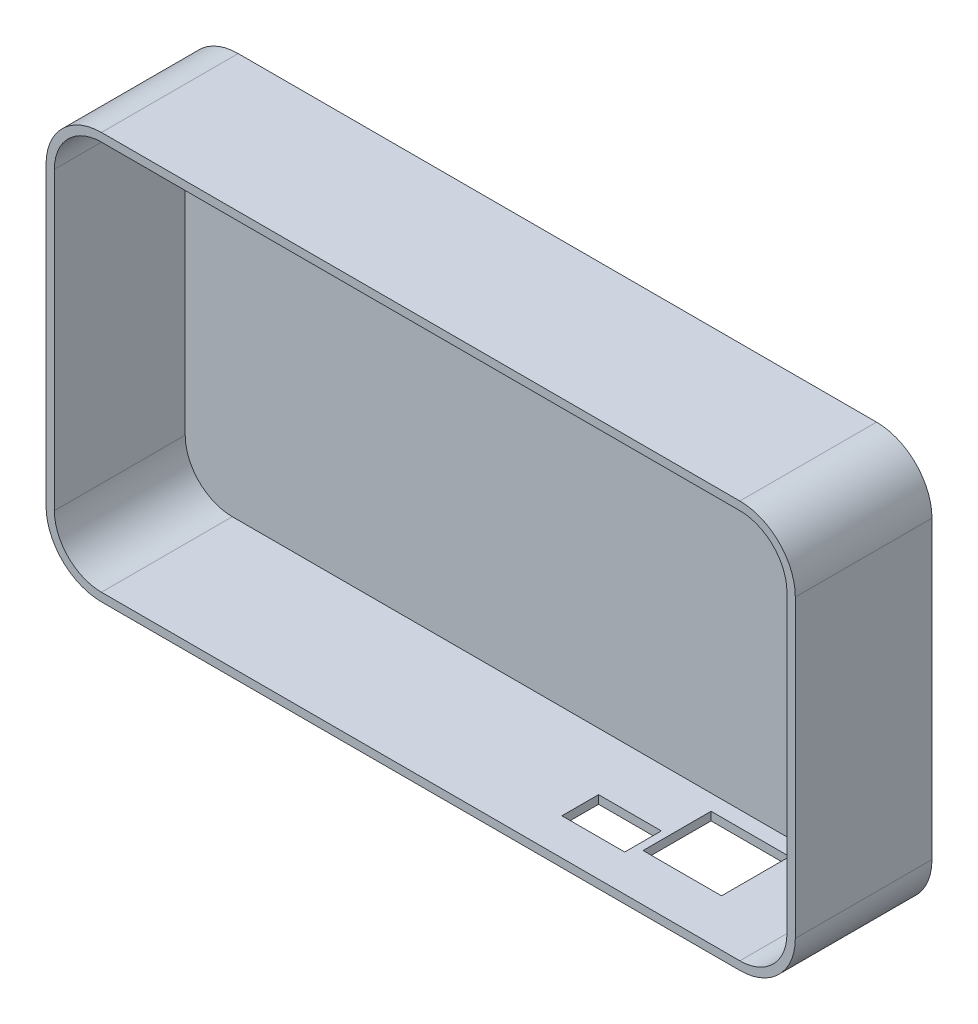
from build123d import *

# Parameters (mm, degrees)
PARED_DEPTH           = 25
CONECTORES_REACH      = 165.441
CROQUIS2_W            = 15
CROQUIS2_H            = 13
CROQUIS2_W_2          = 12
CROQUIS2_H_2          = 7
BASE_START            = -1.12
BASE_FRENTE_DEPTH     = 1.12
CORTAR_EXTRUIR2_REACH = 164.686
CROQUIS3_W            = 2
CROQUIS3_H            = 5.5


with BuildPart() as part:
    # Croquis1 → pared (new body)
    with BuildSketch(Plane.XY):
        with BuildLine():
            Line((9, 76.1), (131, 76.1))
            ThreePointArc((131, 76.1), (138.495331881, 72.995331881), (141.6, 65.5))
            Line((141.6, 65.5), (141.6, 9))
            ThreePointArc((141.6, 9), (138.495331881, 1.504668119), (131, -1.6))
            Line((131, -1.6), (9, -1.6))
            ThreePointArc((9, -1.6), (1.504668119, 1.504668119), (-1.6, 9))
            Line((-1.6, 9), (-1.6, 65.5))
            ThreePointArc((-1.6, 65.5), (1.504668119, 72.995331881), (9, 76.1))
        make_face()
        with BuildLine():
            Line((9, 0), (131, 0))
            ThreePointArc((131, 0), (137.363961031, 2.636038969), (140, 9))
            Line((140, 9), (140, 65.5))
            ThreePointArc((140, 65.5), (137.363961031, 71.863961031), (131, 74.5))
            Line((131, 74.5), (9, 74.5))
            ThreePointArc((9, 74.5), (2.636038969, 71.863961031), (0, 65.5))
            Line((0, 65.5), (0, 9))
            ThreePointArc((0, 9), (2.636038969, 2.636038969), (9, 0))
        make_face(mode=Mode.SUBTRACT)
    extrude(amount=PARED_DEPTH)

    # Croquis2 → conectores (cut, up to next)
    with BuildSketch(Plane.XZ.offset(1.6), mode=Mode.PRIVATE) as conectores_sk1:
        with Locations((111, 9.5)):
            Rectangle(CROQUIS2_W, CROQUIS2_H)
    conectores_tool1 = extrude(conectores_sk1.sketch, amount=-CONECTORES_REACH, mode=Mode.PRIVATE) & part.part
    # Croquis2 → conectores (cut, up to next)
    with BuildSketch(Plane.XZ.offset(1.6), mode=Mode.PRIVATE) as conectores_sk2:
        with Locations((96, 14.5)):
            Rectangle(CROQUIS2_W_2, CROQUIS2_H_2)
    conectores_tool2 = extrude(conectores_sk2.sketch, amount=-CONECTORES_REACH, mode=Mode.PRIVATE) & part.part
    add(conectores_tool1.solids().sort_by_distance((111, -1.6, 9.5))[0], mode=Mode.SUBTRACT)
    add(conectores_tool2.solids().sort_by_distance((96, -1.6, 14.5))[0], mode=Mode.SUBTRACT)

    # Croquis1<2> → base frente (add)
    with BuildSketch(Plane.XY.offset(BASE_START)):
        with BuildLine():
            Line((9, 76.1), (131, 76.1))
            ThreePointArc((131, 76.1), (138.495331881, 72.995331881), (141.6, 65.5))
            Line((141.6, 65.5), (141.6, 9))
            ThreePointArc((141.6, 9), (138.495331881, 1.504668119), (131, -1.6))
            Line((131, -1.6), (9, -1.6))
            ThreePointArc((9, -1.6), (1.504668119, 1.504668119), (-1.6, 9))
            Line((-1.6, 9), (-1.6, 65.5))
            ThreePointArc((-1.6, 65.5), (1.504668119, 72.995331881), (9, 76.1))
        make_face()
    extrude(amount=BASE_FRENTE_DEPTH)

    # Croquis3 → Cortar-Extruir2 (cut, up to next)
    with BuildSketch(Plane.XY, mode=Mode.PRIVATE) as cortar_extruir2_sk1:
        with Locations((132, 38.25)):
            Rectangle(CROQUIS3_W, CROQUIS3_H)
    cortar_extruir2_tool1 = extrude(cortar_extruir2_sk1.sketch, amount=-CORTAR_EXTRUIR2_REACH, mode=Mode.PRIVATE) & part.part
    # Croquis3 → Cortar-Extruir2 (cut, up to next)
    with BuildSketch(Plane.XY, mode=Mode.PRIVATE) as cortar_extruir2_sk2:
        with BuildLine():
            Line((133, 34.5), (131, 34.5))
            Line((131, 34.5), (131, 29.5))
            ThreePointArc((131, 29.5), (131.146446609, 29.146446609), (131.5, 29))
            Line((131.5, 29), (132.5, 29))
            ThreePointArc((132.5, 29), (132.853553391, 29.146446609), (133, 29.5))
            Line((133, 29.5), (133, 34.5))
        make_face()
    cortar_extruir2_tool2 = extrude(cortar_extruir2_sk2.sketch, amount=-CORTAR_EXTRUIR2_REACH, mode=Mode.PRIVATE) & part.part
    # Croquis3 → Cortar-Extruir2 (cut, up to next)
    with BuildSketch(Plane.XY, mode=Mode.PRIVATE) as cortar_extruir2_sk3:
        with Locations((132, 44.75)):
            Rectangle(CROQUIS3_W, CROQUIS3_H)
    cortar_extruir2_tool3 = extrude(cortar_extruir2_sk3.sketch, amount=-CORTAR_EXTRUIR2_REACH, mode=Mode.PRIVATE) & part.part
    # Croquis3 → Cortar-Extruir2 (cut, up to next)
    with BuildSketch(Plane.XY, mode=Mode.PRIVATE) as cortar_extruir2_sk4:
        with BuildLine():
            Line((131, 53.5), (131, 48.5))
            Line((131, 48.5), (133, 48.5))
            Line((133, 48.5), (133, 53.5))
            ThreePointArc((133, 53.5), (132.853553391, 53.853553391), (132.5, 54))
            Line((132.5, 54), (131.5, 54))
            ThreePointArc((131.5, 54), (131.146446609, 53.853553391), (131, 53.5))
        make_face()
    cortar_extruir2_tool4 = extrude(cortar_extruir2_sk4.sketch, amount=-CORTAR_EXTRUIR2_REACH, mode=Mode.PRIVATE) & part.part
    # Croquis3 → Cortar-Extruir2 (cut, up to next)
    with BuildSketch(Plane.XY, mode=Mode.PRIVATE) as cortar_extruir2_sk5:
        with BuildLine():
            Line((132.5, 28), (131.5, 28))
            ThreePointArc((131.5, 28), (131.146446609, 27.853553391), (131, 27.5))
            Line((131, 27.5), (131, 13.5))
            ThreePointArc((131, 13.5), (131.146446609, 13.146446609), (131.5, 13))
            Line((131.5, 13), (132.5, 13))
            ThreePointArc((132.5, 13), (132.853553391, 13.146446609), (133, 13.5))
            Line((133, 13.5), (133, 27.5))
            ThreePointArc((133, 27.5), (132.853553391, 27.853553391), (132.5, 28))
        make_face()
    cortar_extruir2_tool5 = extrude(cortar_extruir2_sk5.sketch, amount=-CORTAR_EXTRUIR2_REACH, mode=Mode.PRIVATE) & part.part
    add(cortar_extruir2_tool1.solids().sort_by_distance((132, 38.25, 0))[0], mode=Mode.SUBTRACT)
    add(cortar_extruir2_tool2.solids().sort_by_distance((132, 31.775989, 0))[0], mode=Mode.SUBTRACT)
    add(cortar_extruir2_tool3.solids().sort_by_distance((132, 44.75, 0))[0], mode=Mode.SUBTRACT)
    add(cortar_extruir2_tool4.solids().sort_by_distance((132, 51.224011, 0))[0], mode=Mode.SUBTRACT)
    add(cortar_extruir2_tool5.solids().sort_by_distance((132, 20.5, 0))[0], mode=Mode.SUBTRACT)


solid = part.part
